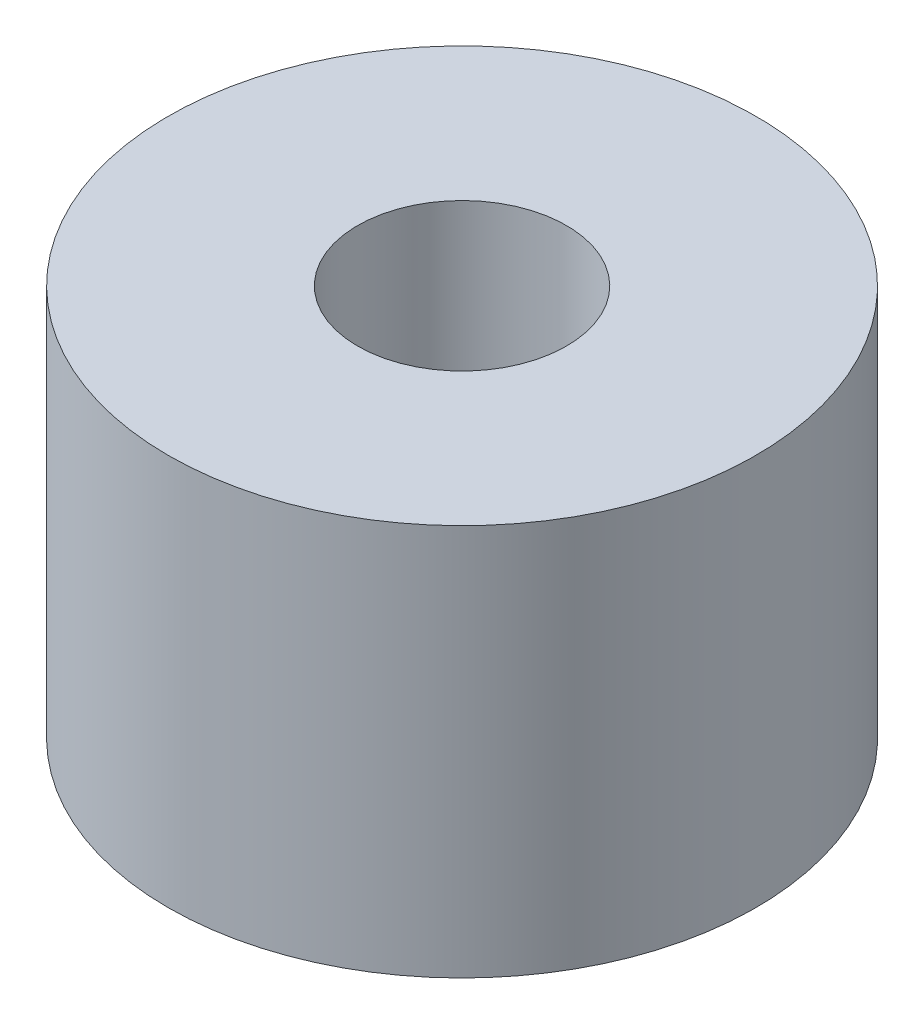
from build123d import *

# Parameters (mm, degrees)
SKETCH1_R           = 11.25
SKETCH1_R_2         = 2.5
BOSS_EXTRUDE1_DEPTH = 15
SKETCH2_R           = 4
CUT_EXTRUDE1_DEPTH  = 10


with BuildPart() as part:
    # Sketch1 → Boss-Extrude1 (new body)
    with BuildSketch(Plane(origin=(0, 0, 0), x_dir=(1, 0, 0), z_dir=(0, 1, 0))):
        with Locations(Location((0, 0, 0), (0, 0, 270))):
            Circle(SKETCH1_R)
        with Locations(Location((0, 0, 0), (0, 0, 270))):
            Circle(SKETCH1_R_2, mode=Mode.SUBTRACT)
    extrude(amount=BOSS_EXTRUDE1_DEPTH)

    # Sketch2 → Cut-Extrude1 (cut)
    with BuildSketch(Plane(origin=(0, 15, 0), x_dir=(1, 0, 0), z_dir=(0, 1, 0))):
        with Locations(Location((0, 0, 0), (0, 0, 270))):
            Circle(SKETCH2_R)
    extrude(amount=-CUT_EXTRUDE1_DEPTH, mode=Mode.SUBTRACT)


solid = part.part
